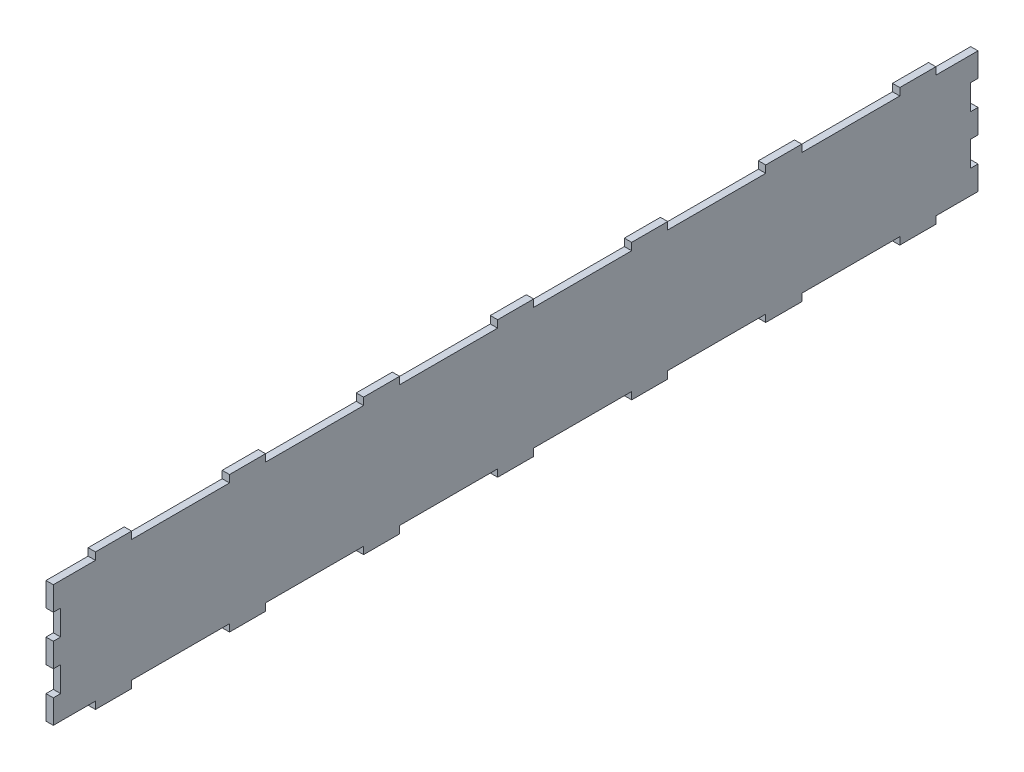
from build123d import *

# Parameters (mm, degrees)
BOSS_EXTRUDE1_DEPTH = 3


with BuildPart() as part:
    # Sketch1 → Boss-Extrude1 (new body)
    with BuildSketch(Plane(origin=(0, 0, 0), x_dir=(0, 0, -1), z_dir=(1, 0, 0))):
        Polygon((7.4, 0), (-7.4, 0), (-7.4, -3), (-47.6, -3), (-47.6, 0), (-62.4, 0), (-62.4, -3), (-102.6, -3), (-102.6, 0), (-117.4, 0), (-117.4, -3), (-157.6, -3), (-157.6, 0), (-172.4, 0), (-172.4, -3), (-189.7, -3), (-189.7, -12.8), (-186.7, -12.8), (-186.7, -23.1), (-189.7, -23.1), (-189.7, -28), (-189.7, -32.9), (-186.7, -32.9), (-186.7, -43.2), (-189.7, -43.2), (-189.7, -53), (-172.4, -53), (-172.4, -56), (-157.6, -56), (-157.6, -53), (-117.4, -53), (-117.4, -56), (-102.6, -56), (-102.6, -53), (-62.4, -53), (-62.4, -56), (-47.6, -56), (-47.6, -53), (-7.4, -53), (-7.4, -56), (7.4, -56), (7.4, -53), (47.6, -53), (47.6, -56), (62.4, -56), (62.4, -53), (102.6, -53), (102.6, -56), (117.4, -56), (117.4, -53), (157.6, -53), (157.6, -56), (172.4, -56), (172.4, -53), (189.7, -53), (189.7, -43.2), (186.7, -43.2), (186.7, -32.9), (189.7, -32.9), (189.7, -28), (189.7, -23.1), (186.7, -23.1), (186.7, -12.8), (189.7, -12.8), (189.7, -3), (172.4, -3), (172.4, 0), (157.6, 0), (157.6, -3), (117.4, -3), (117.4, 0), (102.6, 0), (102.6, -3), (62.4, -3), (62.4, 0), (47.6, 0), (47.6, -3), (7.4, -3), align=None)
    extrude(amount=BOSS_EXTRUDE1_DEPTH)


solid = part.part
